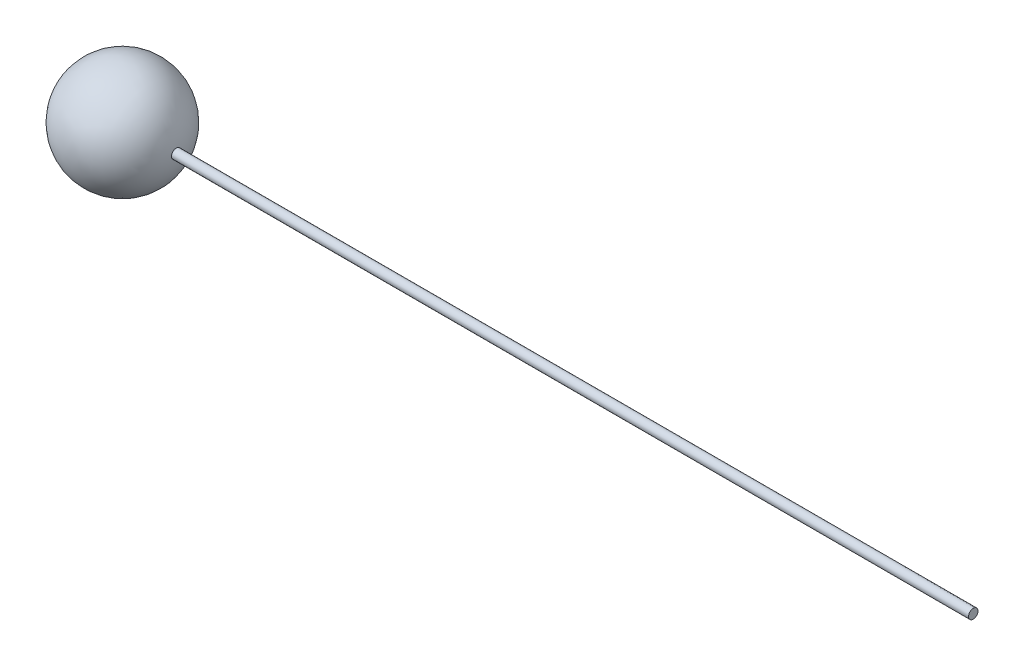
from build123d import *

# Parameters (mm, degrees)
SKETCH4_W = 1800
SKETCH4_H = 10


with BuildPart() as part:
    # Sketch2 → Revolve1 (revolve)
    with BuildSketch(Plane.XY):
        with BuildLine():
            Line((0, 114.3), (0, -114.3))
            ThreePointArc((0, -114.3), (-114.3, 0), (0, 114.3))
        make_face()
    revolve(axis=Axis((0, 114.3, 0), (0, -1, 0)))

    # Sketch4 → Revolve-Thin1 (revolve)
    with BuildSketch(Plane.XY, mode=Mode.PRIVATE) as revolve_thin1_sk:
        with Locations((900, 5)):
            Rectangle(SKETCH4_W, SKETCH4_H)
    revolve(revolve_thin1_sk.sketch.rotate(Axis((0, 0, 0), (1, 0, 0)), 90), axis=Axis((0, 0, 0), (1, 0, 0)))


solid = part.part
